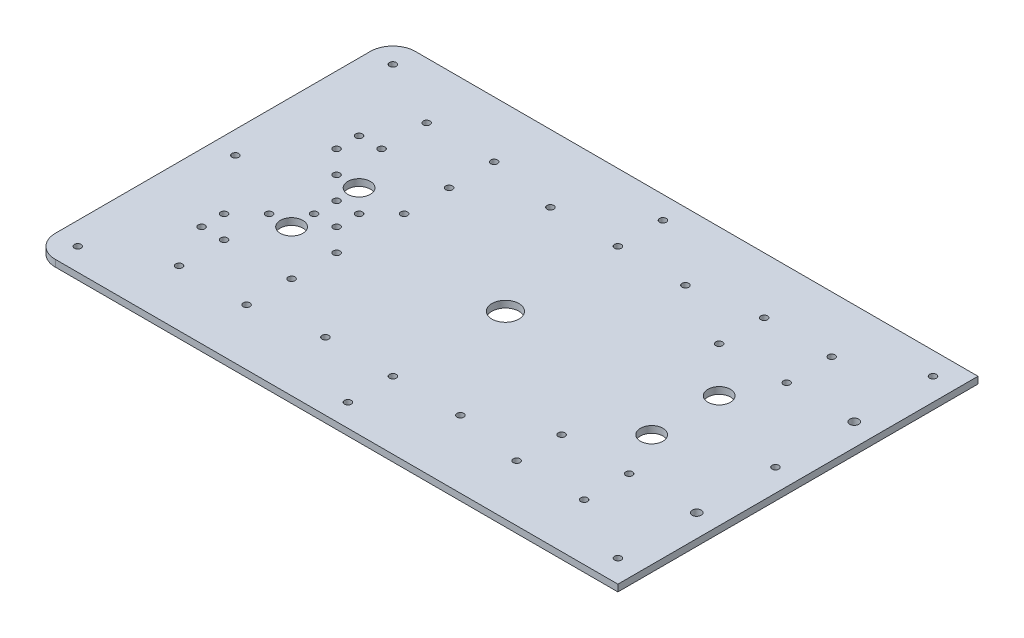
from build123d import *

# Parameters (mm, degrees)
SKETCH_1_W                 = 260
SKETCH_1_H                 = 160
EXTRUDE_1_DEPTH            = 3
SKETCH_2_R                 = 1.5
SKETCH_2_R_2               = 5
CUT_EXTRUDE_1_DEPTH        = 10
MIRROR_2_COPY_1_SKETCH_R   = 1.5
MIRROR_2_COPY_1_SKETCH_R_2 = 5
MIRROR_2_COPY_1_DEPTH      = 10
SKETCH_3_R                 = 6
CUT_EXTRUDE_2_DEPTH        = 10
SKETCH_4_R                 = 1.5
CUT_EXTRUDE_3_DEPTH        = 10
SKETCH_5_R                 = 1.5
CUT_EXTRUDE_4_DEPTH        = 10
FILLET_1_R                 = 10
SKETCH_6_R                 = 1.5
CUT_EXTRUDE_5_DEPTH        = 10
SKETCH_7_R                 = 1.5
CUT_EXTRUDE_6_DEPTH        = 10
SKETCH_8_R                 = 2
CUT_EXTRUDE_7_DEPTH        = 153.672852859


with BuildPart() as part:
    # 草图1 → 凸台-拉伸1 (new body)
    with BuildSketch(Plane(origin=(0, 0, 0), x_dir=(1, 0, 0), z_dir=(0, 1, 0))):
        Rectangle(SKETCH_1_W, SKETCH_1_H)
    extrude(amount=EXTRUDE_1_DEPTH)

    # 草图2 → 切除-拉伸1 (cut)
    with BuildSketch(Plane(origin=(0, 3, 0), x_dir=(1, 0, 0), z_dir=(0, 1, 0))):
        with Locations(Location((-90, 55, 0), (0, 0, 270))):
            Circle(SKETCH_2_R)
        with Locations(Location((-60, 55, 0), (0, 0, 270))):
            Circle(SKETCH_2_R)
        with Locations(Location((-90, 35, 0), (0, 0, 270))):
            Circle(SKETCH_2_R)
        with Locations(Location((-60, 35, 0), (0, 0, 270))):
            Circle(SKETCH_2_R)
        with Locations(Location((-80, 15, 0), (0, 0, 270))):
            Circle(SKETCH_2_R_2)
    cut_extrude_1 = extrude(amount=-CUT_EXTRUDE_1_DEPTH, mode=Mode.SUBTRACT)

    # 镜向1: 切除-拉伸1 across plane
    add(cut_extrude_1.mirror(Plane.XY), mode=Mode.SUBTRACT)

    # 镜向2: 切除-拉伸1 across plane
    add(cut_extrude_1.mirror(Plane(origin=(0, 0, 0), x_dir=(0, 0, 1), z_dir=(1, 0, 0))), mode=Mode.SUBTRACT)

    # 镜向2 copy 1 sketch → 镜向2 copy 1 (cut)
    with BuildSketch(Plane(origin=(0, 3, 0), x_dir=(-1, 0, 0), z_dir=(0, 1, 0))):
        with Locations(Location((-90, 55, 0), (0, 0, 270))):
            Circle(MIRROR_2_COPY_1_SKETCH_R)
        with Locations(Location((-60, 55, 0), (0, 0, 270))):
            Circle(MIRROR_2_COPY_1_SKETCH_R)
        with Locations(Location((-90, 35, 0), (0, 0, 270))):
            Circle(MIRROR_2_COPY_1_SKETCH_R)
        with Locations(Location((-60, 35, 0), (0, 0, 270))):
            Circle(MIRROR_2_COPY_1_SKETCH_R)
        with Locations(Location((-80, 15, 0), (0, 0, 270))):
            Circle(MIRROR_2_COPY_1_SKETCH_R_2)
    extrude(amount=-MIRROR_2_COPY_1_DEPTH, mode=Mode.SUBTRACT)

    # 草图3 → 切除-拉伸2 (cut)
    with BuildSketch(Plane(origin=(0, 3, 0), x_dir=(1, 0, 0), z_dir=(0, 1, 0))):
        with Locations(Location((0, 0, 0), (0, 0, 270))):
            Circle(SKETCH_3_R)
    extrude(amount=-CUT_EXTRUDE_2_DEPTH, mode=Mode.SUBTRACT)

    # 草图4 → 切除-拉伸3 (cut)
    with BuildSketch(Plane.XZ):
        with Locations(Location((0, 50, 0), (0, 0, 270))):
            Circle(SKETCH_4_R)
        with Locations(Location((-30, 50, 0), (0, 0, 270))):
            Circle(SKETCH_4_R)
        with Locations(Location((30, 50, 0), (0, 0, 270))):
            Circle(SKETCH_4_R)
    cut_extrude_3 = extrude(amount=-CUT_EXTRUDE_3_DEPTH, mode=Mode.SUBTRACT)

    # 镜向3: 切除-拉伸3 across plane
    add(cut_extrude_3.mirror(Plane.XY), mode=Mode.SUBTRACT)

    # 草图5 → 切除-拉伸4 (cut)
    with BuildSketch(Plane(origin=(0, 3, 0), x_dir=(1, 0, 0), z_dir=(0, 1, 0))):
        with Locations(Location((-80, 5, 0), (0, 0, 270))):
            Circle(SKETCH_5_R)
        with Locations(Location((-70, 5, 0), (0, 0, 270))):
            Circle(SKETCH_5_R)
        with Locations(Location((-90, 15, 0), (0, 0, 270))):
            Circle(SKETCH_5_R)
        with Locations(Location((-60, 15, 0), (0, 0, 270))):
            Circle(SKETCH_5_R)
        with Locations(Location((-100, 25, 0), (0, 0, 270))):
            Circle(SKETCH_5_R)
        with Locations(Location((-100, 35, 0), (0, 0, 270))):
            Circle(SKETCH_5_R)
    cut_extrude_4 = extrude(amount=-CUT_EXTRUDE_4_DEPTH, mode=Mode.SUBTRACT)

    # 镜向4: 切除-拉伸4 across plane
    add(cut_extrude_4.mirror(Plane.XY), mode=Mode.SUBTRACT)

    # 圆角1
    fillet_1_edges = [part.edges().sort_by_distance(p)[0] for p in [
        (-130, 1.5, -80),
        (-130, 1.5, 80),
    ]]
    fillet(fillet_1_edges, radius=FILLET_1_R)

    # 草图6 → 切除-拉伸5 (cut)
    with BuildSketch(Plane(origin=(0, 3, 0), x_dir=(1, 0, 0), z_dir=(0, 1, 0))):
        with Locations(Location((-120, 70, 0), (0, 0, 270))):
            Circle(SKETCH_6_R)
        with Locations(Location((0, 70, 0), (0, 0, 270))):
            Circle(SKETCH_6_R)
        with Locations(Location((120, 70, 0), (0, 0, 270))):
            Circle(SKETCH_6_R)
    cut_extrude_5 = extrude(amount=-CUT_EXTRUDE_5_DEPTH, mode=Mode.SUBTRACT)

    # 镜向5: 切除-拉伸5 across plane
    add(cut_extrude_5.mirror(Plane.XY), mode=Mode.SUBTRACT)

    # 草图7 → 切除-拉伸6 (cut)
    with BuildSketch(Plane(origin=(0, 3, 0), x_dir=(1, 0, 0), z_dir=(0, 1, 0))):
        with Locations(Location((-120, 0, 0), (0, 0, 270))):
            Circle(SKETCH_7_R)
        with Locations(Location((120, 0, 0), (0, 0, 270))):
            Circle(SKETCH_7_R)
    extrude(amount=-CUT_EXTRUDE_6_DEPTH, mode=Mode.SUBTRACT)

    # 草图8 → 切除-拉伸7 (cut, through all)
    with BuildSketch(Plane(origin=(0, 0, 0), x_dir=(-1, 0, 0), z_dir=(0, -1, 0))):
        with Locations(Location((-120, 35, 0), (0, 0, 90))):
            Circle(SKETCH_8_R)
        with Locations(Location((-120, -35, 0), (0, 0, 90))):
            Circle(SKETCH_8_R)
    extrude(amount=-CUT_EXTRUDE_7_DEPTH, mode=Mode.SUBTRACT)


solid = part.part
